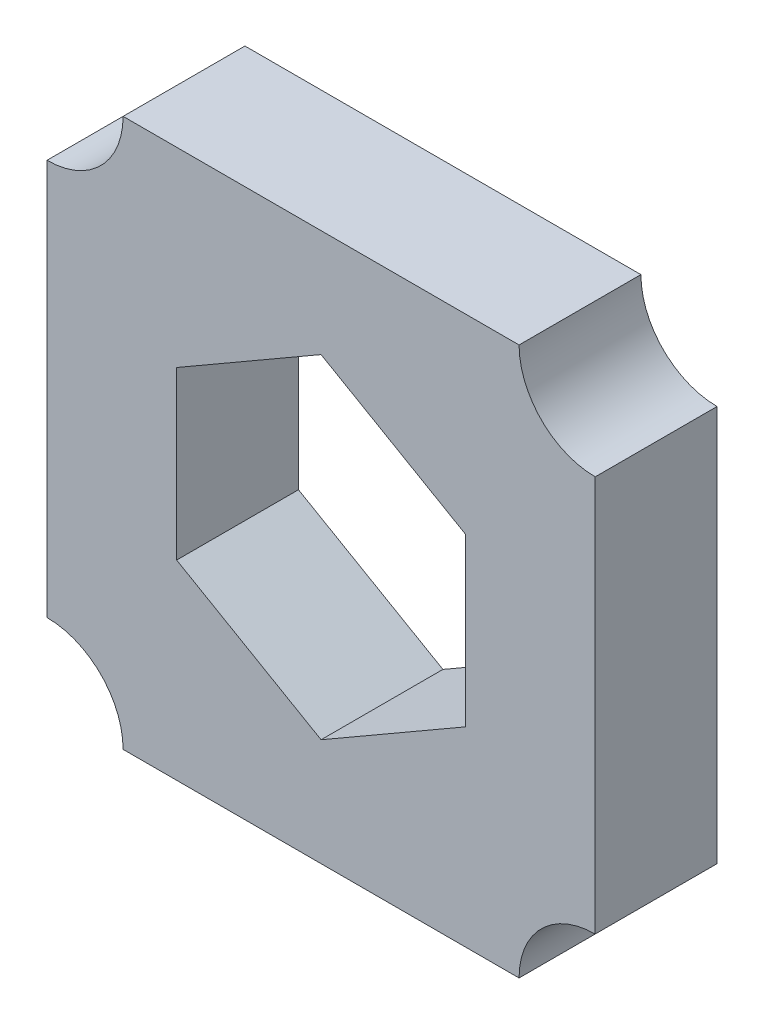
from build123d import *

# Parameters (mm, degrees)
BOSS_EXTRUDE3_DEPTH = 10


with BuildPart() as part:
    # Sketch1 → Boss-Extrude3 (new, symmetric)
    with BuildSketch(Plane.XY):
        with BuildLine():
            Line((12.5, 0), (77.5, 0))
            ThreePointArc((77.5, 0), (81.161165235, 8.838834765), (90, 12.5))
            Line((90, 12.5), (90, 77.5))
            ThreePointArc((90, 77.5), (81.161165235, 81.161165235), (77.5, 90))
            Line((77.5, 90), (12.5, 90))
            ThreePointArc((12.5, 90), (8.838834765, 81.161165235), (0, 77.5))
            Line((0, 77.5), (0, 12.5))
            ThreePointArc((0, 12.5), (8.838834765, 8.838834765), (12.5, 0))
        make_face()
        Polygon((45, 72.378151261), (21.2898255, 58.68907563), (21.2898255, 31.31092437), (45, 17.621848739), (68.7101745, 31.31092437), (68.7101745, 58.68907563), align=None, mode=Mode.SUBTRACT)
    extrude(amount=BOSS_EXTRUDE3_DEPTH, both=True)


solid = part.part
